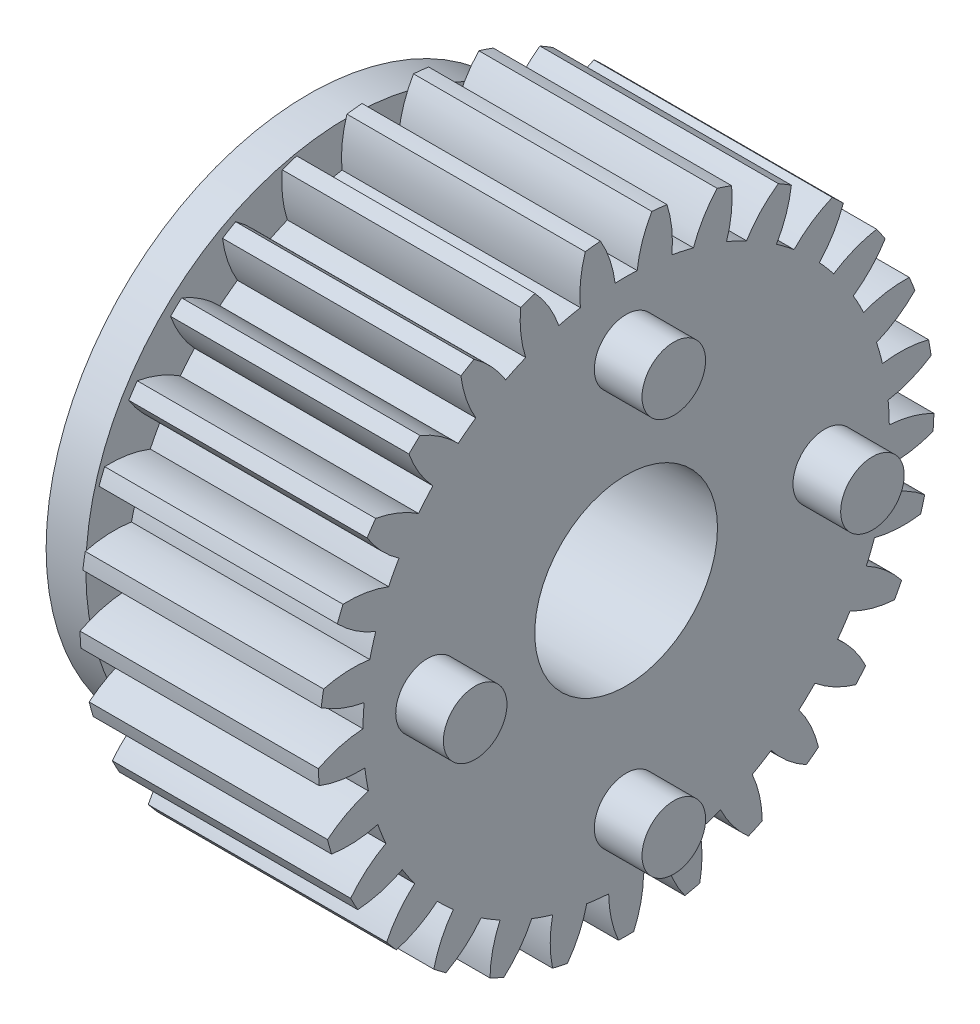
from build123d import *

# Parameters (mm, degrees)
BASPROSKE_W             = 30
BASPROSKE_H             = 38.75
TOOTHCUT_DEPTH          = 63.474994998
TEETHCUTS_COUNT         = 29
TEETHCUTS_ANGLE         = 347.586206897
BORSKE_R                = 6
BORE_DEPTH              = 50.0000508
ESQUISSE1_R             = 4
BOSS_EXTRU_1_DEPTH      = 6
ESQUISSE2_R             = 11.5
ENL_V_MAT_EXTRU_1_DEPTH = 63.46458662
ESQUISSE3_R             = 23
ESQUISSE3_R_2           = 8
BOSS_EXTRU_2_DEPTH      = 5
ESQUISSE4_R             = 33
ESQUISSE4_R_2           = 8
BOSS_EXTRU_3_DEPTH      = 5


with BuildPart() as part:
    # BasProSke → Base-Revolve (revolve)
    with BuildSketch(Plane(origin=(0, 0, 0), x_dir=(1, 0, 0), z_dir=(0, 1, 0)), mode=Mode.PRIVATE) as base_revolve_sk:
        with Locations((15, 19.375)):
            Rectangle(BASPROSKE_W, BASPROSKE_H)
    revolve(base_revolve_sk.sketch.rotate(Axis((-10, 0, 0), (1, 0, 0)), 180), axis=Axis((-10, 0, 0), (1, 0, 0)))

    # TooCutSke → ToothCut (cut, through all)
    with BuildSketch(Plane(origin=(0, 0, 0), x_dir=(0, 0, -1), z_dir=(1, 0, 0))):
        with BuildLine():
            ThreePointArc((1.38827379, 33.094894952), (0, 33.124), (-1.38827379, 33.094894952))
            ThreePointArc((-1.38827379, 33.094894952), (-2.036611336, 35.961759797), (-3.249771531, 38.63897812))
            ThreePointArc((-3.249771531, 38.63897812), (0, 38.7754), (3.249771531, 38.63897812))
            ThreePointArc((3.249771531, 38.63897812), (2.036611336, 35.961759797), (1.38827379, 33.094894952))
        make_face()
    toothcut = extrude(amount=TOOTHCUT_DEPTH, mode=Mode.SUBTRACT)

    # TeethCuts: ToothCut ×29 about axis
    teethcuts_axis = Axis((-10, 0, 0), (1, 0, 0))
    for i in range(1, TEETHCUTS_COUNT):
        add(toothcut.rotate(teethcuts_axis, i * TEETHCUTS_ANGLE / (TEETHCUTS_COUNT - 1)), mode=Mode.SUBTRACT)

    # BorSke → Bore (cut, symmetric)
    with BuildSketch(Plane(origin=(0, 0, 0), x_dir=(0, 0, -1), z_dir=(1, 0, 0))):
        with Locations(Location((0, 0, 0), (0, 0, 180))):
            Circle(BORSKE_R)
    extrude(amount=BORE_DEPTH, both=True, mode=Mode.SUBTRACT)

    # Esquisse1 → Boss.-Extru.1 (add)
    with BuildSketch(Plane(origin=(30, 0, 0), x_dir=(0, 0, -1), z_dir=(1, 0, 0))):
        with Locations(Location((0, 25, 0), (0, 0, 180))):
            Circle(ESQUISSE1_R)
        with Locations(Location((-25, 0, 0), (0, 0, 180))):
            Circle(ESQUISSE1_R)
        with Locations(Location((25, 0, 0), (0, 0, 180))):
            Circle(ESQUISSE1_R)
        with Locations(Location((0, -25, 0), (0, 0, 180))):
            Circle(ESQUISSE1_R)
    extrude(amount=BOSS_EXTRU_1_DEPTH)

    # Esquisse2 → Enlèv. mat.-Extru.1 (cut, through all)
    with BuildSketch(Plane(origin=(30, 0, 0), x_dir=(0, 0, -1), z_dir=(1, 0, 0))):
        Circle(ESQUISSE2_R)
    extrude(amount=-ENL_V_MAT_EXTRU_1_DEPTH, mode=Mode.SUBTRACT)

    # Esquisse3 → Boss.-Extru.2 (add)
    with BuildSketch(Plane.ZY):
        with Locations(Location((0, 0, 0), (0, 0, 180))):
            Circle(ESQUISSE3_R)
        Circle(ESQUISSE3_R_2, mode=Mode.SUBTRACT)
    extrude(amount=BOSS_EXTRU_2_DEPTH)

    # Esquisse4 → Boss.-Extru.3 (add)
    with BuildSketch(Plane.ZY.offset(5)):
        Circle(ESQUISSE4_R)
        Circle(ESQUISSE4_R_2, mode=Mode.SUBTRACT)
    extrude(amount=BOSS_EXTRU_3_DEPTH)


solid = part.part
